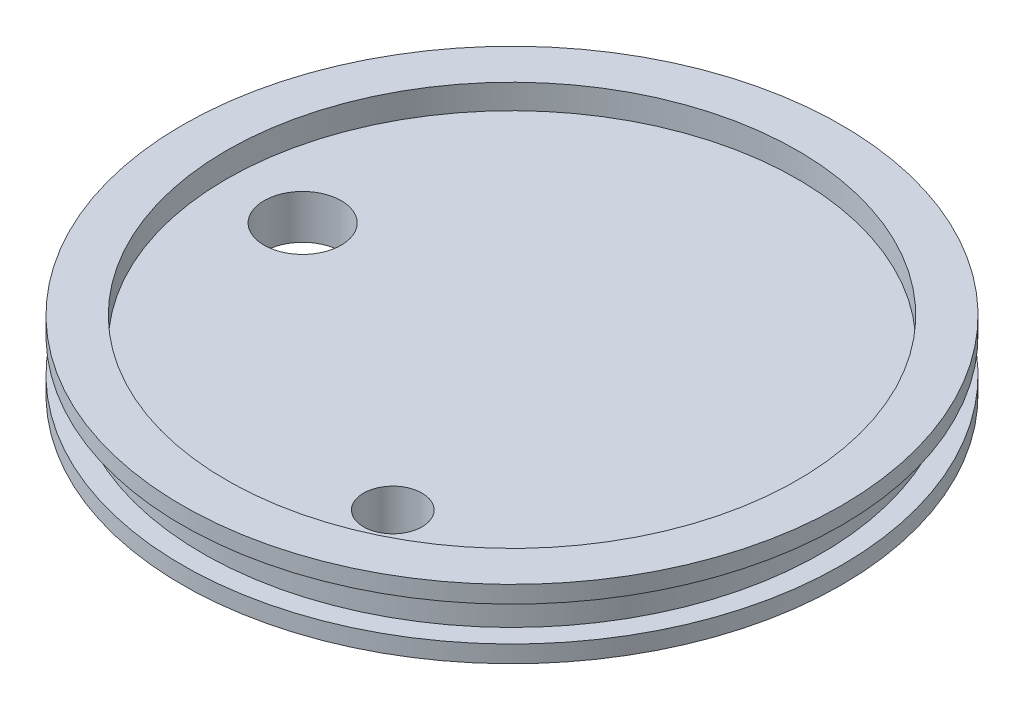
from build123d import *

# Parameters (mm, degrees)
PIPE_TAP_DRILL_FOR_1_4_TAP1_D = 11.1252
PIPE_TAP_DRILL_FOR_1_8_TAP1_D = 8.4328


with BuildPart() as part:
    # Sketch1 → Revolve1 (revolve)
    with BuildSketch(Plane.XY, mode=Mode.PRIVATE) as revolve1_sk:
        Polygon((0, 0), (47.498, 0), (47.498, 2.4638), (44.577, 2.4638), (44.577, 7.4422), (47.498, 7.4422), (47.498, 9.906), (41.148, 9.906), (41.148, 6.35), (0, 6.35), align=None)
    revolve(revolve1_sk.sketch.rotate(Axis((0, 48.192213231, 0), (0, -1, 0)), 180), axis=Axis((0, 48.192213231, 0), (0, -1, 0)))

    # Pipe Tap Drill for 1/4 Tap1 (through all)
    with Locations(Plane(origin=(0, 6.35, 0), x_dir=(1, 0, 0), z_dir=(0, 1, 0))):
        with Locations((-30.1752, 0)):
            Hole(PIPE_TAP_DRILL_FOR_1_4_TAP1_D / 2)

    # Pipe Tap Drill for 1/8 Tap1 (through all)
    with Locations(Plane(origin=(0, 6.35, 0), x_dir=(1, 0, 0), z_dir=(0, 1, 0))):
        with Locations((12.150198978, -29.333175157)):
            Hole(PIPE_TAP_DRILL_FOR_1_8_TAP1_D / 2)


solid = part.part
